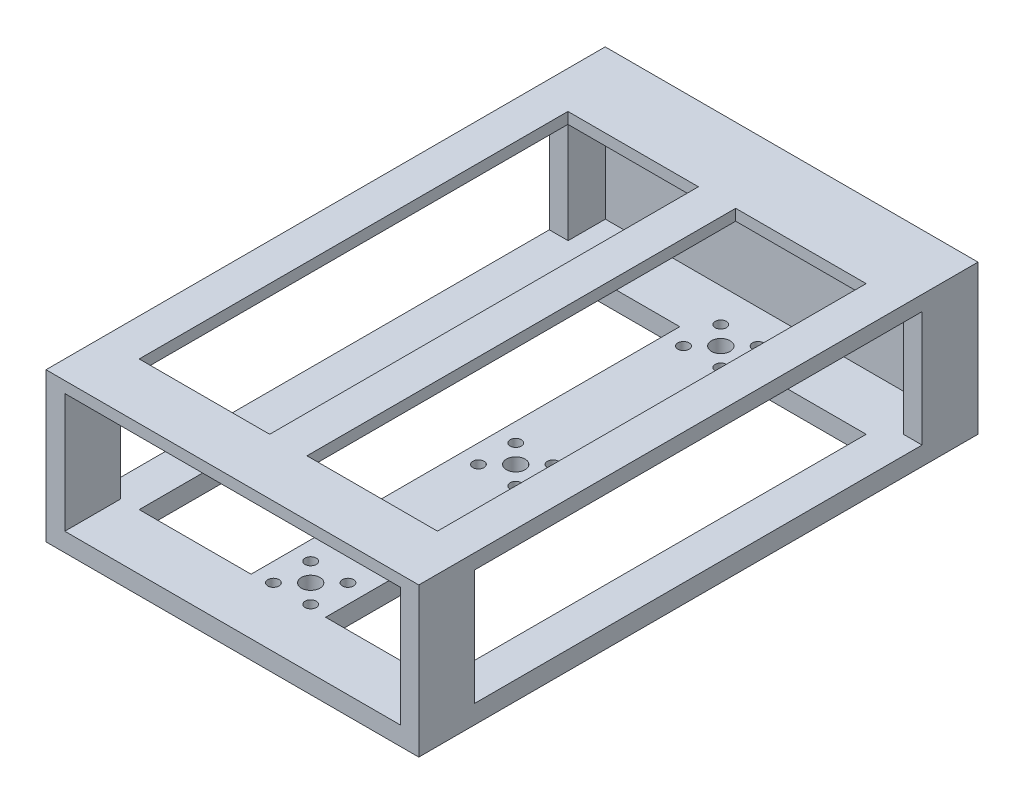
from build123d import *

# Parameters (mm, degrees)
SKETCH_2_W          = 100
SKETCH_2_H          = 40
EXTRUDE_1_DEPTH     = 150
SKETCH_3_W          = 90
SKETCH_3_H          = 32
CUT_EXTRUDE_1_DEPTH = 145
SKETCH_4_W          = 30
SKETCH_4_H          = 115
CUT_EXTRUDE_2_DEPTH = 20
SKETCH_5_W          = 35
SKETCH_5_H          = 115
CUT_EXTRUDE_3_DEPTH = 20
SKETCH_6_W          = 120
SKETCH_6_H          = 31
CUT_EXTRUDE_4_DEPTH = 207
SKETCH_7_R          = 1.5
CUT_EXTRUDE_5_DEPTH = 15
SKETCH_8_R          = 2.5
SKETCH_8_R_2        = 1.5
CUT_EXTRUDE_6_DEPTH = 15


with BuildPart() as part:
    # 草图2 → 凸台-拉伸1 (new body)
    with BuildSketch(Plane.XY):
        Rectangle(SKETCH_2_W, SKETCH_2_H)
    extrude(amount=EXTRUDE_1_DEPTH)

    # 草图3 → 切除-拉伸1 (cut)
    with BuildSketch(Plane.XY.offset(150)):
        with Locations((0.044588489, 1)):
            Rectangle(SKETCH_3_W, SKETCH_3_H)
    extrude(amount=-CUT_EXTRUDE_1_DEPTH, mode=Mode.SUBTRACT)

    # 草图4 → 切除-拉伸2 (cut)
    with BuildSketch(Plane.XZ.offset(20)):
        with Locations((-25, 77.5)):
            Rectangle(SKETCH_4_W, SKETCH_4_H)
        with Locations((25, 77.5)):
            Rectangle(SKETCH_4_W, SKETCH_4_H)
    extrude(amount=-CUT_EXTRUDE_2_DEPTH, mode=Mode.SUBTRACT)

    # 草图5 → 切除-拉伸3 (cut)
    with BuildSketch(Plane(origin=(0, 20, 0), x_dir=(1, 0, 0), z_dir=(0, 1, 0))):
        with Locations((-22.5, -77.5)):
            Rectangle(SKETCH_5_W, SKETCH_5_H)
        with Locations((22.5, -77.5)):
            Rectangle(SKETCH_5_W, SKETCH_5_H)
    extrude(amount=-CUT_EXTRUDE_3_DEPTH, mode=Mode.SUBTRACT)

    # 草图6 → 切除-拉伸4 (cut)
    with BuildSketch(Plane.ZY.offset(50)):
        with Locations((75, 0.5)):
            Rectangle(SKETCH_6_W, SKETCH_6_H)
    extrude(amount=-CUT_EXTRUDE_4_DEPTH, mode=Mode.SUBTRACT)

    # 草图7 → 切除-拉伸5 (cut)
    with BuildSketch(Plane.XZ.offset(20)):
        with Locations(Location((-5, 134, 0), (0, 0, 270))):
            Circle(SKETCH_7_R)
        with Locations(Location((5, 134, 0), (0, 0, 270))):
            Circle(SKETCH_7_R)
        with Locations(Location((5, 124, 0), (0, 0, 270))):
            Circle(SKETCH_7_R)
        with Locations(Location((-5, 124, 0), (0, 0, 270))):
            Circle(SKETCH_7_R)
    extrude(amount=-CUT_EXTRUDE_5_DEPTH, mode=Mode.SUBTRACT)

    # 草图8 → 切除-拉伸6 (cut)
    with BuildSketch(Plane.XZ.offset(20)):
        with Locations(Location((0, 129, 0), (0, 0, 270))):
            Circle(SKETCH_8_R)
        with Locations(Location((0, 74, 0), (0, 0, 270))):
            Circle(SKETCH_8_R)
        with Locations(Location((0, 19, 0), (0, 0, 270))):
            Circle(SKETCH_8_R)
        with Locations(Location((-5, 79, 0), (0, 0, 270))):
            Circle(SKETCH_8_R_2)
        with Locations(Location((-5, 69, 0), (0, 0, 270))):
            Circle(SKETCH_8_R_2)
        with Locations(Location((5, 69, 0), (0, 0, 270))):
            Circle(SKETCH_8_R_2)
        with Locations(Location((5, 79, 0), (0, 0, 270))):
            Circle(SKETCH_8_R_2)
        with Locations(Location((-5, 14, 0), (0, 0, 270))):
            Circle(SKETCH_8_R_2)
        with Locations(Location((-5, 24, 0), (0, 0, 270))):
            Circle(SKETCH_8_R_2)
        with Locations(Location((5, 24, 0), (0, 0, 270))):
            Circle(SKETCH_8_R_2)
        with Locations(Location((5, 14, 0), (0, 0, 270))):
            Circle(SKETCH_8_R_2)
    extrude(amount=-CUT_EXTRUDE_6_DEPTH, mode=Mode.SUBTRACT)


solid = part.part
